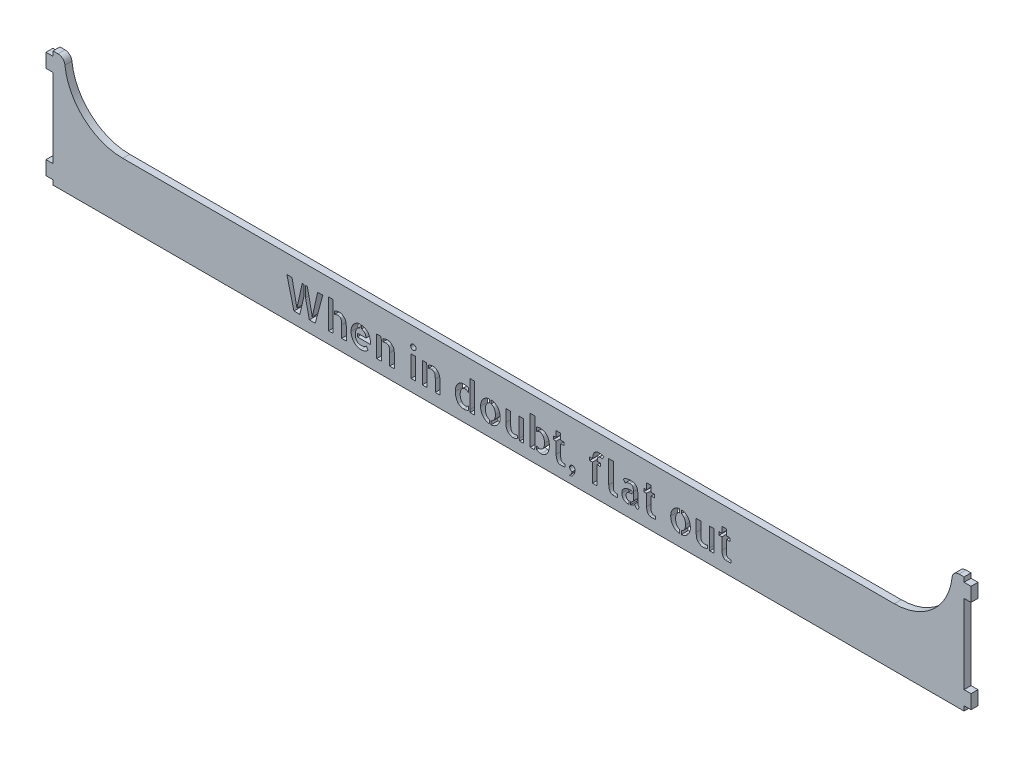
from build123d import *

# Parameters (mm, degrees)
SKETCH1_W           = 3
SKETCH1_H           = 6
BOSS_EXTRUDE1_DEPTH = 3
FILLET1_R           = 3
SKETCH2_W           = 1.968241206
SKETCH2_H           = 12.651256281
SKETCH2_W_2         = 1.985125629
SKETCH2_H_2         = 9.182713568
CUT_EXTRUDE1_DEPTH  = 3


with BuildPart() as part:
    # Sketch1 → Boss-Extrude1 (new body)
    with BuildSketch(Plane.XY):
        with Locations((-197.5, 20)):
            Rectangle(SKETCH1_W, SKETCH1_H)
        with BuildLine():
            Line((-196, 17), (-196, 0))
            Line((-196, 0), (-166, 0))
            ThreePointArc((-166, 0), (-183.67766953, 7.32233047), (-191, 25))
            Line((-191, 25), (-196, 25))
            Line((-196, 25), (-196, 23))
            Line((-196, 23), (-196, 17))
        make_face()
        Polygon((-166, 0), (-196, 0), (-196, -17), (-196, -23), (-196, -25), (196, -25), (196, -23), (196, -17), (196, 0), (166, 0), align=None)
        with Locations((-197.5, -20)):
            Rectangle(SKETCH1_W, SKETCH1_H)
        with Locations((197.5, -20)):
            Rectangle(SKETCH1_W, SKETCH1_H)
        with BuildLine():
            ThreePointArc((191, 25), (183.67766953, 7.32233047), (166, 0))
            Line((166, 0), (196, 0))
            Line((196, 0), (196, 17))
            Line((196, 17), (196, 23))
            Line((196, 23), (196, 25))
            Line((196, 25), (191, 25))
        make_face()
        with Locations((197.5, 20)):
            Rectangle(SKETCH1_W, SKETCH1_H)
    extrude(amount=BOSS_EXTRUDE1_DEPTH)

    # Fillet1
    fillet1_edges = [part.edges().sort_by_distance(p)[0] for p in [
        (-191, 25, 1.5),
        (191, 25, 1.5),
    ]]
    fillet(fillet1_edges, radius=FILLET1_R)

    # Sketch2 → Cut-Extrude1 (cut)
    with BuildSketch(Plane.XY.offset(3)):
        Polygon((-91.04080402, -18.354974874), (-88.761407035, -8), (-87.994371859, -8), (-87.994371859, -12.346532663), (-89.769648241, -20.065125628), (-92.326432161, -20.065125628), (-95.370452261, -8), (-93.156180905, -8), align=None)
        Polygon((-82.133065327, -8), (-79.91879397, -8), (-83.160603015, -20.065125628), (-85.700502513, -20.065125628), (-87.328643216, -12.657688442), (-87.328643216, -8), (-86.547135678, -8), (-84.429346734, -18.354974874), align=None)
        with Locations((-76.421306533, -13.67437186)):
            Rectangle(SKETCH2_W, SKETCH2_H)
        with BuildLine():
            add(Edge.make_bspline(
                [(-70.567236181, -11.825527638), (-70.522944215, -11.873009838), (-70.434756304, -11.967549694), (-70.318129612, -12.122836034), (-70.21883544, -12.290714491), (-70.107971968, -12.529311814), (-69.994784468, -12.84341581), (-69.902610081, -13.235603246), (-69.846506391, -13.637172126), (-69.816155838, -14.040115684), (-69.80652438, -14.440952562), (-69.803911393, -14.706331041), (-69.802613065, -14.838190955)],
                knots=[0, 0, 0, 0, 0.61080383, 1.216146378, 1.823471959, 2.442885967, 3.689936612, 4.958134669, 6.227280472, 7.502300055, 8.758955501, 10, 10, 10, 10], degree=3))
            Line((-69.802613065, -14.838190955), (-69.802613065, -19.674371859))
            Line((-69.802613065, -19.674371859), (-69.802613065, -20))
            Line((-69.802613065, -20), (-71.790150754, -20))
            Line((-71.790150754, -20), (-71.790150754, -15.002211055))
            add(Edge.make_bspline(
                [(-71.790150754, -15.002211055), (-71.792394575, -14.821234473), (-71.796777229, -14.467749318), (-71.827270149, -14.032595846), (-71.864425981, -13.700895962), (-71.917646609, -13.470181615), (-71.980918198, -13.252300282), (-72.063720476, -13.050148208), (-72.157620193, -12.863535366), (-72.27335715, -12.699757752), (-72.403815767, -12.556146234), (-72.552774108, -12.43293874), (-72.726257856, -12.333254406), (-72.929887136, -12.264103684), (-73.164262342, -12.224041544), (-73.330485827, -12.218963712), (-73.418291457, -12.216281407)],
                knots=[0, 0, 0, 0, 2.063446306, 4.030342651, 4.973105725, 5.86515059, 6.726658374, 7.557518502, 8.353076957, 9.103447919, 9.836764699, 10.559923288, 11.299120169, 12.105228101, 12.999108693, 14, 14, 14, 14], degree=3))
            add(Edge.make_bspline(
                [(-73.418291457, -12.216281407), (-73.459336845, -12.217305328), (-73.548074359, -12.21951898), (-73.691056131, -12.236390625), (-73.854102193, -12.256112065), (-74.095240005, -12.303694305), (-74.409558967, -12.374203874), (-74.648891323, -12.476220818), (-74.769045226, -12.527437186)],
                knots=[0, 0, 0, 0, 0.529680917, 1.145136404, 1.856989334, 2.648777967, 4.317559676, 6, 6, 6, 6], degree=3))
            Line((-74.769045226, -12.527437186), (-74.769045226, -11.273165829))
            add(Edge.make_bspline(
                [(-74.769045226, -11.273165829), (-74.617509109, -11.199555908), (-74.308243666, -11.049327663), (-73.899957061, -10.905261122), (-73.564722935, -10.806996107), (-73.312003069, -10.757226335), (-73.063033199, -10.723406748), (-72.897395729, -10.720054119), (-72.815276382, -10.71839196)],
                knots=[0, 0, 0, 0, 1.47892298, 3.018288834, 3.796376008, 4.545755503, 5.27901815, 6, 6, 6, 6], degree=3))
            add(Edge.make_bspline(
                [(-72.815276382, -10.71839196), (-72.697644363, -10.721982746), (-72.470633978, -10.728912371), (-72.143806514, -10.785273737), (-71.844326493, -10.877066786), (-71.57355552, -11.016165468), (-71.319562578, -11.183607141), (-71.067026825, -11.373446589), (-70.814051565, -11.587637714), (-70.65079487, -11.74499064), (-70.567236181, -11.825527638)],
                knots=[0, 0, 0, 0, 1.091950854, 2.107284947, 3.070906179, 3.989338024, 4.923543776, 5.894372448, 6.922289352, 8, 8, 8, 8], degree=3))
        make_face()
        with BuildLine():
            add(Edge.make_bspline(
                [(-63.261105528, -10.735276382), (-63.117489042, -10.752404458), (-62.834926, -10.786103662), (-62.425264997, -10.887085125), (-62.036798638, -11.0241497), (-61.671684797, -11.201941373), (-61.329291426, -11.41138201), (-61.012457686, -11.65128526), (-60.720030375, -11.918561613), (-60.455533923, -12.214781425), (-60.219545622, -12.537519726), (-60.0074396, -12.8792552), (-59.832100117, -13.247788845), (-59.682959272, -13.633830324), (-59.56510256, -14.035643031), (-59.480577441, -14.447834148), (-59.428313742, -14.868198119), (-59.421911584, -15.151610107), (-59.418693467, -15.294070352)],
                knots=[0, 0, 0, 0, 1.056658311, 2.078957625, 3.077434928, 4.063391262, 5.042365449, 6.007635579, 6.964599913, 7.93463772, 8.905814863, 9.88478905, 10.870745384, 11.88495041, 12.908060698, 13.928380565, 14.95867704, 16, 16, 16, 16], degree=3))
            add(Edge.make_bspline(
                [(-59.418693467, -15.294070352), (-59.42071872, -15.42444463), (-59.42477692, -15.68568855), (-59.452864336, -15.945450592), (-59.466934673, -16.075577889)],
                knots=[0, 0, 0, 0, 0.998103827, 2, 2, 2, 2], degree=3))
            Line((-59.466934673, -16.075577889), (-65.050854271, -16.075577889))
            Line((-65.050854271, -16.075577889), (-65.050854271, -14.64281407))
            Line((-65.050854271, -14.64281407), (-61.290452261, -14.64281407))
            add(Edge.make_bspline(
                [(-61.290452261, -14.64281407), (-61.292795707, -14.572830213), (-61.297442083, -14.434072416), (-61.319745565, -14.227494284), (-61.368456879, -14.026776766), (-61.427596993, -13.828688481), (-61.503983902, -13.635954863), (-61.600528389, -13.452015747), (-61.707015249, -13.271857812), (-61.879882393, -13.049540651), (-62.117627109, -12.78741141), (-62.402776003, -12.577638796), (-62.645665305, -12.436459499), (-62.841551987, -12.357020126), (-63.04698561, -12.298012887), (-63.189219311, -12.277368524), (-63.261105528, -12.266934673)],
                knots=[0, 0, 0, 0, 0.875648736, 1.736158786, 2.59225216, 3.454170767, 4.320476351, 5.179340166, 6.050126722, 6.932904018, 8.69696932, 10.456473006, 11.334427602, 12.204517342, 13.092546593, 14, 14, 14, 14], degree=3))
            Line((-63.261105528, -12.266934673), (-63.261105528, -10.735276382))
        make_face()
        with BuildLine():
            add(Edge.make_bspline(
                [(-63.326231156, -18.468341709), (-63.259446932, -18.465947265), (-63.110120306, -18.460593394), (-62.867614995, -18.431739237), (-62.593760309, -18.37401496), (-62.301282268, -18.285268193), (-62.002223815, -18.163485272), (-61.702613041, -18.020582359), (-61.419535632, -17.844020952), (-61.257059114, -17.695039654), (-61.177085427, -17.621708543)],
                knots=[0, 0, 0, 0, 0.679604328, 1.519565779, 2.480358209, 3.523014247, 4.62408012, 5.761628527, 6.898235741, 8, 8, 8, 8], degree=3))
            Line((-61.177085427, -17.621708543), (-60.460703518, -18.714371859))
            add(Edge.make_bspline(
                [(-60.460703518, -18.714371859), (-60.551499751, -18.82126093), (-60.729760376, -19.031116689), (-61.037095331, -19.302293029), (-61.361716911, -19.538257889), (-61.715904534, -19.732774373), (-62.10537763, -19.884576173), (-62.541031223, -19.98862732), (-63.023539083, -20.05412033), (-63.3621838, -20.061357657), (-63.538492462, -20.065125628)],
                knots=[0, 0, 0, 0, 0.962884687, 1.890435528, 2.809135884, 3.716849467, 4.660008601, 5.673338514, 6.788669792, 8, 8, 8, 8], degree=3))
            add(Edge.make_bspline(
                [(-63.538492462, -20.065125628), (-63.685871365, -20.060203047), (-63.976560444, -20.050493782), (-64.405840406, -19.981750925), (-64.819337115, -19.864663412), (-65.217437932, -19.705974702), (-65.592910738, -19.505911317), (-65.941588866, -19.269933459), (-66.265848098, -19.004434348), (-66.556456694, -18.700922702), (-66.820781684, -18.370496202), (-67.051668231, -18.00953868), (-67.261047061, -17.626627231), (-67.435730579, -17.216017803), (-67.579720736, -16.785134655), (-67.678859461, -16.334739075), (-67.745512642, -15.869328125), (-67.751658595, -15.553203044), (-67.754773869, -15.392964824)],
                knots=[0, 0, 0, 0, 1.010106514, 1.99232676, 2.97121678, 3.950665208, 4.924577524, 5.881498951, 6.832753172, 7.791593184, 8.756496667, 9.728770122, 10.72506919, 11.744753508, 12.783518584, 13.834464996, 14.902328561, 16, 16, 16, 16], degree=3))
            add(Edge.make_bspline(
                [(-67.754773869, -15.392964824), (-67.750916113, -15.240040045), (-67.743276552, -14.937201323), (-67.686899112, -14.489856861), (-67.592528767, -14.054727334), (-67.459526467, -13.634964769), (-67.296121127, -13.232282858), (-67.103831367, -12.853424223), (-66.882518969, -12.501289321), (-66.636328599, -12.175308005), (-66.366005539, -11.874927034), (-66.071574014, -11.604919876), (-65.75574134, -11.364548474), (-65.421600938, -11.154513377), (-65.06907422, -10.979639151), (-64.701104847, -10.846762685), (-64.319969292, -10.754641054), (-64.059970639, -10.730519837), (-63.929246231, -10.71839196)],
                knots=[0, 0, 0, 0, 1.106804155, 2.191817174, 3.258060847, 4.325701457, 5.375149816, 6.400698683, 7.397046155, 8.381818038, 9.354319488, 10.318214252, 11.269248844, 12.223643396, 13.171091624, 14.111884337, 15.050676608, 16, 16, 16, 16], degree=3))
            Line((-63.929246231, -10.71839196), (-63.929246231, -12.281407035))
            add(Edge.make_bspline(
                [(-63.929246231, -12.281407035), (-64.025754035, -12.303625365), (-64.213784212, -12.346914262), (-64.476872879, -12.456089854), (-64.716931307, -12.591853925), (-64.923289731, -12.767775991), (-65.109264003, -12.959368259), (-65.269955577, -13.169977263), (-65.417564141, -13.388176689), (-65.574907713, -13.700683347), (-65.727948584, -14.106831247), (-65.831156079, -14.522822212), (-65.880262082, -14.848238909), (-65.910446108, -15.072401591), (-65.928561671, -15.278487919), (-65.930385106, -15.409817813), (-65.931256281, -15.472562814)],
                knots=[0, 0, 0, 0, 1.017869342, 1.983157262, 2.921560874, 3.844653398, 4.763729224, 5.666104131, 6.568327174, 7.471612727, 9.260979002, 11.025611856, 11.872041706, 12.648210099, 13.354160298, 14, 14, 14, 14], degree=3))
            add(Edge.make_bspline(
                [(-65.931256281, -15.472562814), (-65.92952234, -15.577160802), (-65.926127543, -15.781947861), (-65.895845063, -16.084081553), (-65.84887887, -16.37447387), (-65.780899036, -16.652588156), (-65.695834278, -16.91710206), (-65.583999829, -17.16281996), (-65.45305576, -17.391831359), (-65.301846157, -17.602795748), (-65.126176853, -17.790482148), (-64.934596625, -17.962139936), (-64.721774401, -18.110394224), (-64.490899914, -18.241573974), (-64.23427198, -18.342511767), (-63.953760345, -18.417549386), (-63.647555539, -18.460563427), (-63.435712579, -18.465691498), (-63.326231156, -18.468341709)],
                knots=[0, 0, 0, 0, 1.117095835, 2.187104889, 3.240472474, 4.257060902, 5.242999496, 6.204044574, 7.135147059, 8.057733062, 8.969460476, 9.876035356, 10.800618214, 11.734963453, 12.706277988, 13.737563801, 14.830762488, 16, 16, 16, 16], degree=3))
        make_face()
        Polygon((-54.96120603, -10.817286432), (-54.751356784, -11.745929648), (-54.751356784, -20), (-56.71959799, -20), (-56.71959799, -10.817286432), align=None)
        with BuildLine():
            add(Edge.make_bspline(
                [(-49.881407035, -11.825527638), (-49.837115069, -11.873009838), (-49.748927158, -11.967549694), (-49.632300466, -12.122836034), (-49.533006294, -12.290714491), (-49.422142822, -12.529311814), (-49.308955323, -12.84341581), (-49.216780935, -13.235603246), (-49.160677245, -13.637172126), (-49.130326693, -14.040115684), (-49.120695235, -14.440952562), (-49.118082247, -14.706331041), (-49.11678392, -14.838190955)],
                knots=[0, 0, 0, 0, 0.61080383, 1.216146378, 1.823471959, 2.442885967, 3.689936612, 4.958134669, 6.227280472, 7.502300055, 8.758955501, 10, 10, 10, 10], degree=3))
            Line((-49.11678392, -14.838190955), (-49.11678392, -19.674371859))
            Line((-49.11678392, -19.674371859), (-49.11678392, -20))
            Line((-49.11678392, -20), (-51.104321608, -20))
            Line((-51.104321608, -20), (-51.104321608, -15.002211055))
            add(Edge.make_bspline(
                [(-51.104321608, -15.002211055), (-51.10656543, -14.821234473), (-51.110948083, -14.467749318), (-51.141441004, -14.032595846), (-51.178596836, -13.700895962), (-51.231817464, -13.470181615), (-51.295089052, -13.252300282), (-51.37789133, -13.050148208), (-51.471791047, -12.863535366), (-51.587528004, -12.699757752), (-51.717986621, -12.556146234), (-51.866944963, -12.43293874), (-52.040428711, -12.333254406), (-52.24405799, -12.264103684), (-52.478433196, -12.224041544), (-52.644656681, -12.218963712), (-52.732462312, -12.216281407)],
                knots=[0, 0, 0, 0, 2.063446306, 4.030342651, 4.973105725, 5.86515059, 6.726658374, 7.557518502, 8.353076957, 9.103447919, 9.836764699, 10.559923288, 11.299120169, 12.105228101, 12.999108693, 14, 14, 14, 14], degree=3))
            add(Edge.make_bspline(
                [(-52.732462312, -12.216281407), (-52.773507699, -12.217305328), (-52.862245213, -12.21951898), (-53.005226985, -12.236390625), (-53.168273047, -12.256112065), (-53.409410859, -12.303694305), (-53.723729821, -12.374203874), (-53.963062177, -12.476220818), (-54.08321608, -12.527437186)],
                knots=[0, 0, 0, 0, 0.529680917, 1.145136404, 1.856989334, 2.648777967, 4.317559676, 6, 6, 6, 6], degree=3))
            Line((-54.08321608, -12.527437186), (-54.08321608, -11.273165829))
            add(Edge.make_bspline(
                [(-54.08321608, -11.273165829), (-53.931679963, -11.199555908), (-53.62241452, -11.049327663), (-53.214127915, -10.905261122), (-52.878893789, -10.806996107), (-52.626173923, -10.757226335), (-52.377204053, -10.723406748), (-52.211566584, -10.720054119), (-52.129447236, -10.71839196)],
                knots=[0, 0, 0, 0, 1.47892298, 3.018288834, 3.796376008, 4.545755503, 5.27901815, 6, 6, 6, 6], degree=3))
            add(Edge.make_bspline(
                [(-52.129447236, -10.71839196), (-52.011815217, -10.721982746), (-51.784804832, -10.728912371), (-51.457977368, -10.785273737), (-51.158497348, -10.877066786), (-50.887726375, -11.016165468), (-50.633733433, -11.183607141), (-50.38119768, -11.373446589), (-50.128222419, -11.587637714), (-49.964965724, -11.74499064), (-49.881407035, -11.825527638)],
                knots=[0, 0, 0, 0, 1.091950854, 2.107284947, 3.070906179, 3.989338024, 4.923543776, 5.894372448, 6.922289352, 8, 8, 8, 8], degree=3))
        make_face()
        with Locations((-40.924221106, -15.408643216)):
            Rectangle(SKETCH2_W_2, SKETCH2_H_2)
        with BuildLine():
            add(Edge.make_bspline(
                [(-39.750753769, -7.886633166), (-39.75489573, -7.965047478), (-39.762979961, -8.118095614), (-39.827799316, -8.339198855), (-39.938456088, -8.538942343), (-40.088338148, -8.714547928), (-40.267881002, -8.85843393), (-40.469816024, -8.964814036), (-40.690749531, -9.029700907), (-40.844590595, -9.037853867), (-40.923015075, -9.04201005)],
                knots=[0, 0, 0, 0, 1.026542015, 2.003592683, 2.989242921, 3.998494226, 5.010602115, 5.986288028, 6.973457985, 8, 8, 8, 8], degree=3))
            add(Edge.make_bspline(
                [(-40.923015075, -9.04201005), (-41.001409202, -9.037785095), (-41.155190721, -9.029497228), (-41.376235072, -8.965681334), (-41.576643411, -8.855681218), (-41.752309646, -8.7077064), (-41.898047345, -8.529467887), (-42.001876499, -8.329604481), (-42.069017443, -8.113562641), (-42.076810668, -7.963518021), (-42.08080402, -7.886633166)],
                knots=[0, 0, 0, 0, 1.033732368, 2.027816899, 3.005972211, 4.030403807, 5.041336525, 6.023856572, 6.987397882, 8, 8, 8, 8], degree=3))
            add(Edge.make_bspline(
                [(-42.08080402, -7.886633166), (-42.076949978, -7.807324614), (-42.06941615, -7.652293385), (-42.000711403, -7.431020179), (-41.893269953, -7.228294153), (-41.742567364, -7.052505596), (-41.566224235, -6.902424459), (-41.367193057, -6.792497769), (-41.149820541, -6.726427744), (-40.999857915, -6.718456454), (-40.923015075, -6.714371859)],
                knots=[0, 0, 0, 0, 1.038272473, 2.029600274, 3.011394499, 4.029914316, 5.048434134, 6.035260479, 6.993241395, 8, 8, 8, 8], degree=3))
            add(Edge.make_bspline(
                [(-40.923015075, -6.714371859), (-40.844637516, -6.718624265), (-40.690888496, -6.726965978), (-40.468548864, -6.790695766), (-40.267680648, -6.903359164), (-40.088782801, -7.051454191), (-39.939078115, -7.22916672), (-39.82717431, -7.429823773), (-39.763090589, -7.652854948), (-39.754933028, -7.807437741), (-39.750753769, -7.886633166)],
                knots=[0, 0, 0, 0, 1.019921578, 2.00072502, 2.980018543, 3.998811027, 5.009556093, 5.988849616, 6.969653058, 8, 8, 8, 8], degree=3))
        make_face()
        Polygon((-35.355979899, -10.817286432), (-35.146130653, -11.745929648), (-35.146130653, -20), (-37.114371859, -20), (-37.114371859, -10.817286432), align=None)
        with BuildLine():
            add(Edge.make_bspline(
                [(-30.276180905, -11.825527638), (-30.231888939, -11.873009838), (-30.143701028, -11.967549694), (-30.027074336, -12.122836034), (-29.927780164, -12.290714491), (-29.816916691, -12.529311814), (-29.703729192, -12.84341581), (-29.611554804, -13.235603246), (-29.555451115, -13.637172126), (-29.525100562, -14.040115684), (-29.515469104, -14.440952562), (-29.512856117, -14.706331041), (-29.511557789, -14.838190955)],
                knots=[0, 0, 0, 0, 0.61080383, 1.216146378, 1.823471959, 2.442885967, 3.689936612, 4.958134669, 6.227280472, 7.502300055, 8.758955501, 10, 10, 10, 10], degree=3))
            Line((-29.511557789, -14.838190955), (-29.511557789, -19.674371859))
            Line((-29.511557789, -19.674371859), (-29.511557789, -20))
            Line((-29.511557789, -20), (-31.499095477, -20))
            Line((-31.499095477, -20), (-31.499095477, -15.002211055))
            add(Edge.make_bspline(
                [(-31.499095477, -15.002211055), (-31.501339299, -14.821234473), (-31.505721953, -14.467749318), (-31.536214873, -14.032595846), (-31.573370705, -13.700895962), (-31.626591333, -13.470181615), (-31.689862921, -13.252300282), (-31.772665199, -13.050148208), (-31.866564917, -12.863535366), (-31.982301873, -12.699757752), (-32.11276049, -12.556146234), (-32.261718832, -12.43293874), (-32.43520258, -12.333254406), (-32.63883186, -12.264103684), (-32.873207066, -12.224041544), (-33.039430551, -12.218963712), (-33.127236181, -12.216281407)],
                knots=[0, 0, 0, 0, 2.063446306, 4.030342651, 4.973105725, 5.86515059, 6.726658374, 7.557518502, 8.353076957, 9.103447919, 9.836764699, 10.559923288, 11.299120169, 12.105228101, 12.999108693, 14, 14, 14, 14], degree=3))
            add(Edge.make_bspline(
                [(-33.127236181, -12.216281407), (-33.168281569, -12.217305328), (-33.257019083, -12.21951898), (-33.400000855, -12.236390625), (-33.563046916, -12.256112065), (-33.804184729, -12.303694305), (-34.11850369, -12.374203874), (-34.357836047, -12.476220818), (-34.47798995, -12.527437186)],
                knots=[0, 0, 0, 0, 0.529680917, 1.145136404, 1.856989334, 2.648777967, 4.317559676, 6, 6, 6, 6], degree=3))
            Line((-34.47798995, -12.527437186), (-34.47798995, -11.273165829))
            add(Edge.make_bspline(
                [(-34.47798995, -11.273165829), (-34.326453832, -11.199555908), (-34.017188389, -11.049327663), (-33.608901784, -10.905261122), (-33.273667658, -10.806996107), (-33.020947792, -10.757226335), (-32.771977922, -10.723406748), (-32.606340453, -10.720054119), (-32.524221106, -10.71839196)],
                knots=[0, 0, 0, 0, 1.47892298, 3.018288834, 3.796376008, 4.545755503, 5.27901815, 6, 6, 6, 6], degree=3))
            add(Edge.make_bspline(
                [(-32.524221106, -10.71839196), (-32.406589086, -10.721982746), (-32.179578701, -10.728912371), (-31.852751237, -10.785273737), (-31.553271217, -10.877066786), (-31.282500244, -11.016165468), (-31.028507302, -11.183607141), (-30.775971549, -11.373446589), (-30.522996288, -11.587637714), (-30.359739594, -11.74499064), (-30.276180905, -11.825527638)],
                knots=[0, 0, 0, 0, 1.091950854, 2.107284947, 3.070906179, 3.989338024, 4.923543776, 5.894372448, 6.922289352, 8, 8, 8, 8], degree=3))
        make_face()
        Polygon((-14.64361809, -7.348743719), (-14.64361809, -20), (-16.515376884, -20), (-16.628743719, -18.909748744), (-16.628743719, -7.348743719), align=None)
        with BuildLine():
            add(Edge.make_bspline(
                [(-22.88080402, -15.27718593), (-22.876970186, -15.073587869), (-22.869614292, -14.682948732), (-22.804706557, -14.121519299), (-22.695373755, -13.611433989), (-22.542379842, -13.150160298), (-22.352849925, -12.737683212), (-22.13997469, -12.364672726), (-21.90206702, -12.03257043), (-21.635858369, -11.743551889), (-21.351446298, -11.491799309), (-21.049092889, -11.279279306), (-20.732472049, -11.10285757), (-20.402773192, -10.967263918), (-20.067035409, -10.864307349), (-19.733298626, -10.789201254), (-19.401457551, -10.743766318), (-19.181643906, -10.738099078), (-19.072160804, -10.735276382)],
                knots=[0, 0, 0, 0, 1.465391904, 2.811615327, 4.061655456, 5.214841032, 6.302767987, 7.324433161, 8.302827141, 9.236932405, 10.147387435, 11.032255896, 11.892452099, 12.751361954, 13.593569408, 14.417923962, 15.212011648, 16, 16, 16, 16], degree=3))
            add(Edge.make_bspline(
                [(-19.072160804, -10.735276382), (-18.907671004, -10.740444527), (-18.584358685, -10.750602756), (-18.117824891, -10.841721734), (-17.683313673, -10.972316946), (-17.423030117, -11.1083455), (-17.296884422, -11.174271357)],
                knots=[0, 0, 0, 0, 1.066858738, 2.096960264, 3.077697135, 4, 4, 4, 4], degree=3))
            Line((-17.296884422, -11.174271357), (-17.296884422, -12.901306533))
            add(Edge.make_bspline(
                [(-17.296884422, -12.901306533), (-17.392109709, -12.809505266), (-17.58012414, -12.628251279), (-17.856086206, -12.451391925), (-18.092364955, -12.348096178), (-18.278437564, -12.288034964), (-18.477027523, -12.258053225), (-18.612179949, -12.252761005), (-18.681407035, -12.250050251)],
                knots=[0, 0, 0, 0, 1.509643925, 2.980666704, 3.71317203, 4.454388414, 5.20831471, 6, 6, 6, 6], degree=3))
            add(Edge.make_bspline(
                [(-18.681407035, -12.250050251), (-18.763627123, -12.253512906), (-18.923758025, -12.260256733), (-19.157437081, -12.306751641), (-19.376133607, -12.386891835), (-19.579399633, -12.499687707), (-19.768531466, -12.637238326), (-19.939691445, -12.801941676), (-20.101583573, -12.985072692), (-20.241171203, -13.195421592), (-20.366953996, -13.423312071), (-20.477971019, -13.667786333), (-20.57402363, -13.929122043), (-20.656513806, -14.205066911), (-20.717803397, -14.494902396), (-20.764598817, -14.79511685), (-20.790686162, -15.106270535), (-20.794732877, -15.317341935), (-20.79678392, -15.424321608)],
                knots=[0, 0, 0, 0, 0.932094573, 1.815336709, 2.689260637, 3.562375793, 4.443120694, 5.33311239, 6.250783575, 7.209125843, 8.188485949, 9.200279658, 10.250249345, 11.343536001, 12.462928955, 13.60659829, 14.78692551, 16, 16, 16, 16], degree=3))
            add(Edge.make_bspline(
                [(-20.79678392, -15.424321608), (-20.795214987, -15.531340608), (-20.792129023, -15.741838382), (-20.759339854, -16.051250025), (-20.708846415, -16.349398116), (-20.639821245, -16.63592919), (-20.550024724, -16.907791622), (-20.446898603, -17.163287673), (-20.329960975, -17.401834103), (-20.201673788, -17.624120957), (-20.054582726, -17.82483991), (-19.890784382, -18.00224259), (-19.715308414, -18.160176683), (-19.523832866, -18.293992587), (-19.318614572, -18.40024804), (-19.103114344, -18.477959413), (-18.878096887, -18.525993185), (-18.725060324, -18.53095641), (-18.647638191, -18.533467337)],
                knots=[0, 0, 0, 0, 1.227357478, 2.414113558, 3.565092595, 4.694882496, 5.791656369, 6.846796086, 7.853362698, 8.83736075, 9.787485868, 10.70146151, 11.603065295, 12.490975925, 13.373841431, 14.246236657, 15.112760395, 16, 16, 16, 16], degree=3))
            add(Edge.make_bspline(
                [(-18.647638191, -18.533467337), (-18.582423959, -18.531589026), (-18.453749334, -18.52788292), (-18.264751378, -18.499259956), (-18.084141973, -18.446845962), (-17.910423886, -18.377916576), (-17.744708465, -18.286443724), (-17.585558713, -18.178519512), (-17.433855223, -18.049412886), (-17.343267617, -17.94999831), (-17.296884422, -17.899095477)],
                knots=[0, 0, 0, 0, 1.015309029, 2.003312862, 2.96633243, 3.93810101, 4.907285525, 5.90735161, 6.928509951, 8, 8, 8, 8], degree=3))
            Line((-17.296884422, -17.899095477), (-17.296884422, -19.592361809))
            add(Edge.make_bspline(
                [(-17.296884422, -19.592361809), (-17.363936853, -19.627166272), (-17.501397777, -19.698517205), (-17.721879403, -19.788033673), (-17.955592743, -19.873067352), (-18.203199393, -19.948105799), (-18.461853988, -20.00756058), (-18.729137334, -20.052249864), (-19.004219639, -20.075227089), (-19.190316415, -20.079732), (-19.284422111, -20.08201005)],
                knots=[0, 0, 0, 0, 0.876643472, 1.797164079, 2.759744532, 3.763794646, 4.798572159, 5.839017888, 6.907231342, 8, 8, 8, 8], degree=3))
            add(Edge.make_bspline(
                [(-19.284422111, -20.08201005), (-19.392343886, -20.079501466), (-19.608361248, -20.074480257), (-19.929981558, -20.025064114), (-20.250134306, -19.953995633), (-20.565233633, -19.851024311), (-20.870508299, -19.713940239), (-21.159701909, -19.538444687), (-21.43278389, -19.325414618), (-21.594723317, -19.157077316), (-21.67718593, -19.071356784)],
                knots=[0, 0, 0, 0, 0.967317371, 1.936192636, 2.912393994, 3.906700598, 4.90401017, 5.907039501, 6.934225009, 8, 8, 8, 8], degree=3))
            add(Edge.make_bspline(
                [(-21.67718593, -19.071356784), (-21.777159924, -18.950019443), (-21.979093393, -18.704935005), (-22.221920806, -18.284772003), (-22.434910175, -17.831048278), (-22.596312432, -17.337970735), (-22.721653879, -16.826936974), (-22.814614622, -16.309852399), (-22.868183189, -15.79289385), (-22.876610047, -15.44855855), (-22.88080402, -15.27718593)],
                knots=[0, 0, 0, 0, 0.927534149, 1.873489111, 2.85766039, 3.885284315, 4.93269433, 5.965292125, 6.987343963, 8, 8, 8, 8], degree=3))
        make_face()
        with BuildLine():
            add(Edge.make_bspline(
                [(-7.484623116, -10.769045226), (-7.337872334, -10.781188093), (-7.049409594, -10.80505689), (-6.629913286, -10.894088929), (-6.230388896, -11.021272902), (-5.855261218, -11.194269525), (-5.502478915, -11.398597259), (-5.17745811, -11.635462242), (-4.883584258, -11.90545482), (-4.620628537, -12.205728179), (-4.385931033, -12.533569084), (-4.178104693, -12.886163456), (-3.999418599, -13.265251388), (-3.847908067, -13.666714481), (-3.727345012, -14.088607913), (-3.64121759, -14.526686665), (-3.585806828, -14.979080196), (-3.580017037, -15.285867166), (-3.577085427, -15.44120603)],
                knots=[0, 0, 0, 0, 1.044722858, 2.053574183, 3.037564271, 4.016106713, 4.980625159, 5.928422644, 6.865881028, 7.808453978, 8.757523052, 9.724926583, 10.710687287, 11.729713132, 12.768804863, 13.822413058, 14.897398148, 16, 16, 16, 16], degree=3))
            add(Edge.make_bspline(
                [(-3.577085427, -15.44120603), (-3.580061876, -15.5957346), (-3.585939931, -15.900906152), (-3.640716272, -16.351157431), (-3.729399434, -16.787048869), (-3.854860675, -17.205597387), (-4.011400884, -17.60302389), (-4.194913734, -17.976042026), (-4.405058463, -18.32333621), (-4.644402519, -18.642299977), (-4.911789771, -18.934854519), (-5.208461111, -19.197660442), (-5.53460708, -19.43050617), (-5.88540426, -19.633121262), (-6.260277862, -19.79872247), (-6.652114082, -19.930578658), (-7.062472296, -20.020244876), (-7.342741819, -20.050041589), (-7.484623116, -20.065125628)],
                knots=[0, 0, 0, 0, 1.106779111, 2.185728504, 3.244324831, 4.290481212, 5.312082913, 6.301372403, 7.265622848, 8.216129645, 9.153895077, 10.100641286, 11.050222437, 12.020545286, 12.9979219, 13.981627271, 14.978235895, 16, 16, 16, 16], degree=3))
            Line((-7.484623116, -20.065125628), (-7.484623116, -18.502110553))
            add(Edge.make_bspline(
                [(-7.484623116, -18.502110553), (-7.417420901, -18.485133549), (-7.28472783, -18.451611876), (-7.093931956, -18.374750733), (-6.912532061, -18.278188425), (-6.740281918, -18.159924338), (-6.581128887, -18.017283991), (-6.427755916, -17.858172282), (-6.286272682, -17.676187774), (-6.153880231, -17.47631476), (-6.034234346, -17.261102283), (-5.930362724, -17.032519621), (-5.840458732, -16.793526179), (-5.768900698, -16.543287958), (-5.713453965, -16.282857428), (-5.672191331, -16.012346351), (-5.647759108, -15.730305492), (-5.645412284, -15.538540364), (-5.644221106, -15.44120603)],
                knots=[0, 0, 0, 0, 0.862964866, 1.703953641, 2.555618301, 3.419978046, 4.300334091, 5.214535364, 6.17065783, 7.168298529, 8.199877862, 9.235584986, 10.294537016, 11.379061552, 12.475645425, 13.6106923, 14.787257737, 16, 16, 16, 16], degree=3))
            add(Edge.make_bspline(
                [(-5.644221106, -15.44120603), (-5.645330626, -15.342253398), (-5.647517049, -15.147257242), (-5.673262475, -14.859089156), (-5.710764692, -14.580337191), (-5.764399666, -14.311425984), (-5.830683099, -14.052952269), (-5.915609147, -13.807438811), (-6.013637657, -13.574279457), (-6.130477314, -13.357654219), (-6.257910724, -13.154921162), (-6.396263666, -12.967474145), (-6.553189619, -12.804300912), (-6.715966688, -12.654948102), (-6.893239457, -12.52989459), (-7.078828635, -12.424605435), (-7.276962346, -12.345690943), (-7.414964081, -12.314191439), (-7.484623116, -12.298291457)],
                knots=[0, 0, 0, 0, 1.206478328, 2.377487413, 3.525735358, 4.635357377, 5.719912831, 6.777354597, 7.800974567, 8.801171334, 9.775114959, 10.720400997, 11.636080551, 12.531854535, 13.410723559, 14.275530654, 15.129540873, 16, 16, 16, 16], degree=3))
            Line((-7.484623116, -12.298291457), (-7.484623116, -10.769045226))
        make_face()
        with BuildLine():
            add(Edge.make_bspline(
                [(-12.026532663, -15.407437186), (-12.023572385, -15.25290756), (-12.017726265, -14.947733923), (-11.962927418, -14.499224256), (-11.876040261, -14.066905318), (-11.756311509, -13.65159822), (-11.601383636, -13.257984819), (-11.421634865, -12.885617625), (-11.206967845, -12.542084017), (-10.966903554, -12.221951195), (-10.694114682, -11.933210529), (-10.401239895, -11.667191517), (-10.076232173, -11.439163001), (-9.732592856, -11.234794327), (-9.364181335, -11.066891154), (-8.977709895, -10.929541615), (-8.570127184, -10.836273551), (-8.291423206, -10.801246973), (-8.150351759, -10.783517588)],
                knots=[0, 0, 0, 0, 1.112820148, 2.197658678, 3.249525204, 4.287004796, 5.306675896, 6.293611338, 7.261219819, 8.220401132, 9.171151153, 10.118737801, 11.065421218, 12.026018014, 12.995289291, 13.977146802, 14.976093453, 16, 16, 16, 16], degree=3))
            Line((-8.150351759, -10.783517588), (-8.150351759, -12.298291457))
            add(Edge.make_bspline(
                [(-8.150351759, -12.298291457), (-8.216683465, -12.315464543), (-8.349113257, -12.34975023), (-8.539874139, -12.42458028), (-8.719876678, -12.521525022), (-8.88775492, -12.642227634), (-9.046629691, -12.781497162), (-9.195027937, -12.942656256), (-9.331733432, -13.124409607), (-9.459853177, -13.323612827), (-9.571350673, -13.540155033), (-9.670984369, -13.767957623), (-9.755820178, -14.006332048), (-9.821791085, -14.256940179), (-9.87971267, -14.516271505), (-9.912743676, -14.788547602), (-9.939452971, -15.070026753), (-9.941482456, -15.261838157), (-9.942512563, -15.35919598)],
                knots=[0, 0, 0, 0, 0.85867219, 1.714320145, 2.562450234, 3.415718742, 4.301603457, 5.207739906, 6.157531389, 7.150440849, 8.174150573, 9.208136185, 10.266847495, 11.343034162, 12.456363992, 13.595687353, 14.779641667, 16, 16, 16, 16], degree=3))
            add(Edge.make_bspline(
                [(-9.942512563, -15.35919598), (-9.936325656, -15.554895236), (-9.924216009, -15.937937815), (-9.848764604, -16.406132178), (-9.758387559, -16.758383192), (-9.675425648, -17.005225747), (-9.581927639, -17.239134806), (-9.476500108, -17.459348288), (-9.356426965, -17.662721194), (-9.220043407, -17.846535549), (-9.073244276, -18.013706508), (-8.913639395, -18.162448227), (-8.740620027, -18.287915905), (-8.555179568, -18.388173909), (-8.357999645, -18.462500594), (-8.220015078, -18.488821897), (-8.150351759, -18.502110553)],
                knots=[0, 0, 0, 0, 2.096834449, 4.104138609, 5.06550086, 5.991938501, 6.892777867, 7.763739395, 8.606055967, 9.41949473, 10.213066864, 10.987461465, 11.752742104, 12.496821617, 13.241100667, 14, 14, 14, 14], degree=3))
            Line((-8.150351759, -18.502110553), (-8.150351759, -20.065125628))
            add(Edge.make_bspline(
                [(-8.150351759, -20.065125628), (-8.296325398, -20.050414436), (-8.583321457, -20.021491035), (-9.000139324, -19.927650129), (-9.395692752, -19.798800331), (-9.766300785, -19.626056346), (-10.109943923, -19.417441875), (-10.431821714, -19.183357161), (-10.724011328, -18.916101433), (-10.991030102, -18.621354678), (-11.227049529, -18.295739561), (-11.437724392, -17.946269506), (-11.617156494, -17.568768534), (-11.764985226, -17.167241068), (-11.884014953, -16.746531966), (-11.963939958, -16.310290723), (-12.017312162, -15.863030602), (-12.02343778, -15.560358196), (-12.026532663, -15.407437186)],
                knots=[0, 0, 0, 0, 1.048047519, 2.060546738, 3.047549508, 4.017074348, 4.976235138, 5.917804722, 6.857758781, 7.801973942, 8.756213491, 9.728188865, 10.715459397, 11.739396715, 12.783986546, 13.836924786, 14.90713643, 16, 16, 16, 16], degree=3))
        make_face()
        with BuildLine():
            add(Edge.make_bspline(
                [(0.928643216, -15.815075377), (0.930899626, -15.998459496), (0.935278581, -16.354348143), (0.965122994, -16.790388791), (1.003188962, -17.118635905), (1.054847552, -17.343884263), (1.109203538, -17.556832024), (1.18506192, -17.753017218), (1.275275373, -17.934137663), (1.390916436, -18.094411272), (1.523976666, -18.237807523), (1.67727396, -18.363265513), (1.855975605, -18.464203035), (2.061643834, -18.532153358), (2.291917425, -18.577320898), (2.454431515, -18.581777058), (2.539899497, -18.584120603)],
                knots=[0, 0, 0, 0, 2.104817037, 4.084762027, 5.015471689, 5.893433029, 6.735286994, 7.535750917, 8.303515627, 9.051327685, 9.795771846, 10.543868623, 11.316609893, 12.136784214, 13.020113919, 14, 14, 14, 14], degree=3))
            add(Edge.make_bspline(
                [(2.539899497, -18.584120603), (2.579318627, -18.582888161), (2.66553123, -18.580192719), (2.805463471, -18.567020957), (2.967310621, -18.548117002), (3.211386831, -18.509094682), (3.527296552, -18.441587547), (3.771740498, -18.351464451), (3.893065327, -18.306733668)],
                knots=[0, 0, 0, 0, 0.511421805, 1.118517964, 1.822190378, 2.62457492, 4.324675748, 6, 6, 6, 6], degree=3))
            Line((3.893065327, -18.306733668), (3.893065327, -19.510351759))
            add(Edge.make_bspline(
                [(3.893065327, -19.510351759), (3.747080456, -19.584418457), (3.448020658, -19.736149056), (3.053568635, -19.887293018), (2.72672665, -19.988771929), (2.478764315, -20.040764771), (2.233065289, -20.077588284), (2.068876711, -20.080545196), (1.987537688, -20.08201005)],
                knots=[0, 0, 0, 0, 1.46606846, 3.003339553, 3.778279975, 4.530033878, 5.271778776, 6, 6, 6, 6], degree=3))
            add(Edge.make_bspline(
                [(1.987537688, -20.08201005), (1.863531942, -20.07824328), (1.62794652, -20.071087192), (1.290748877, -20.019090753), (0.984862391, -19.924014072), (0.706207646, -19.784590533), (0.443288455, -19.619439629), (0.191221531, -19.431783262), (-0.055366262, -19.222261102), (-0.211618309, -19.068373496), (-0.291859296, -18.989346734)],
                knots=[0, 0, 0, 0, 1.140773642, 2.167235363, 3.128843999, 4.075077838, 5.025466655, 5.982740358, 6.964065374, 8, 8, 8, 8], degree=3))
            add(Edge.make_bspline(
                [(-0.291859296, -18.989346734), (-0.337417082, -18.943038509), (-0.428613111, -18.850340277), (-0.541175955, -18.691117413), (-0.648460777, -18.52668672), (-0.764494584, -18.288674184), (-0.880754876, -17.975051849), (-0.977256246, -17.583096695), (-1.030022758, -17.181736054), (-1.052900882, -16.777792493), (-1.053740524, -16.37707965), (-1.055574005, -16.110950497), (-1.056482412, -15.979095477)],
                knots=[0, 0, 0, 0, 0.609257256, 1.219590484, 1.827300626, 2.452229234, 3.702291853, 4.962695042, 6.236023471, 7.499704226, 8.761215958, 10, 10, 10, 10], degree=3))
            Line((-1.056482412, -15.979095477), (-1.056482412, -10.817286432))
            Line((-1.056482412, -10.817286432), (0.928643216, -10.817286432))
            Line((0.928643216, -10.817286432), (0.928643216, -15.815075377))
        make_face()
        Polygon((6.546331658, -10.817286432), (6.546331658, -20), (4.771055276, -20), (4.55879397, -19.054472362), (4.55879397, -10.817286432), align=None)
        with BuildLine():
            Line((9.351557789, -7.348743719), (11.319798995, -7.348743719))
            Line((11.319798995, -7.348743719), (11.319798995, -18.909748744))
            add(Edge.make_bspline(
                [(11.319798995, -18.909748744), (11.313916854, -18.991005811), (11.301321887, -19.164995199), (11.270055909, -19.43374237), (11.244374002, -19.715993892), (11.230292885, -19.905909062), (11.223316583, -20)],
                knots=[0, 0, 0, 0, 0.89306077, 1.912241015, 2.96564765, 4, 4, 4, 4], degree=3))
            Line((11.223316583, -20), (9.351557789, -20))
            Line((9.351557789, -20), (9.351557789, -7.348743719))
        make_face()
        with BuildLine():
            add(Edge.make_bspline(
                [(17.376482412, -13.60080402), (17.406243089, -13.728314988), (17.46689874, -13.988196868), (17.528666156, -14.391104978), (17.565199972, -14.812577164), (17.569608938, -15.099422046), (17.571859296, -15.245829146)],
                knots=[0, 0, 0, 0, 0.945818162, 1.927685168, 2.942279873, 4, 4, 4, 4], degree=3))
            add(Edge.make_bspline(
                [(17.571859296, -15.245829146), (17.568932527, -15.399490028), (17.563099376, -15.705741355), (17.520609056, -16.161586101), (17.453954805, -16.612161194), (17.35733442, -17.052672502), (17.23779805, -17.479297651), (17.081094993, -17.880630295), (16.90165117, -18.258918571), (16.690646508, -18.608659134), (16.456360659, -18.932765841), (16.184891171, -19.217543906), (15.890420312, -19.473393866), (15.566082358, -19.692119079), (15.211388179, -19.867601896), (14.825877475, -19.99351858), (14.410240224, -20.069631597), (14.122942485, -20.077811463), (13.975477387, -20.08201005)],
                knots=[0, 0, 0, 0, 1.093010144, 2.178406122, 3.254265627, 4.331280043, 5.384862611, 6.402462909, 7.3925076, 8.359702735, 9.304638495, 10.231254795, 11.151920514, 12.075194331, 13.006301314, 13.957706536, 14.951725107, 16, 16, 16, 16], degree=3))
            add(Edge.make_bspline(
                [(13.975477387, -20.08201005), (13.881319555, -20.081157267), (13.69422156, -20.079462728), (13.417644733, -20.049488387), (13.146255659, -20.013920583), (12.884711727, -19.955067553), (12.635566492, -19.882595339), (12.400623435, -19.802307838), (12.184951269, -19.706261041), (12.052469288, -19.629668606), (11.987939698, -19.592361809)],
                knots=[0, 0, 0, 0, 1.090537696, 2.166972327, 3.221157943, 4.261123207, 5.269683307, 6.2274216, 7.136608948, 8, 8, 8, 8], degree=3))
            Line((11.987939698, -19.592361809), (11.987939698, -17.899095477))
            add(Edge.make_bspline(
                [(11.987939698, -17.899095477), (12.07329778, -17.987081946), (12.245063165, -18.164136413), (12.507543265, -18.33193148), (12.735174917, -18.436903904), (12.918109846, -18.490746874), (13.109766406, -18.52665746), (13.240432852, -18.531161287), (13.307336683, -18.533467337)],
                knots=[0, 0, 0, 0, 1.45826144, 2.934447861, 3.681257516, 4.442699935, 5.202631253, 6, 6, 6, 6], degree=3))
            add(Edge.make_bspline(
                [(13.307336683, -18.533467337), (13.387158049, -18.530963296), (13.544160504, -18.52603804), (13.773429839, -18.478742505), (13.990394977, -18.400238942), (14.196048757, -18.293470447), (14.388706666, -18.160230749), (14.567279826, -18.004855771), (14.733723846, -17.82996888), (14.881945512, -17.631182571), (15.017709575, -17.413387939), (15.13749997, -17.17530049), (15.247155994, -16.9199293), (15.337529301, -16.644450255), (15.412519871, -16.355438265), (15.464539087, -16.053676748), (15.500685671, -15.742789251), (15.503366407, -15.531363111), (15.504723618, -15.424321608)],
                knots=[0, 0, 0, 0, 0.908292162, 1.786540474, 2.65267311, 3.529200864, 4.418268723, 5.31424307, 6.221195397, 7.162631032, 8.133364707, 9.140896335, 10.195483225, 11.295952261, 12.439842535, 13.593151909, 14.781453249, 16, 16, 16, 16], degree=3))
            add(Edge.make_bspline(
                [(15.504723618, -15.424321608), (15.502932306, -15.319729205), (15.499397768, -15.113352089), (15.469424869, -14.807973173), (15.421552901, -14.510576793), (15.35402097, -14.222226108), (15.270226252, -13.945833276), (15.170798062, -13.684049828), (15.058575662, -13.438284105), (14.930626395, -13.210468115), (14.787656666, -13.002352855), (14.63282999, -12.813069112), (14.457791788, -12.649882281), (14.271947591, -12.507270797), (14.06974151, -12.391838254), (13.854266789, -12.309766337), (13.625589199, -12.259707853), (13.469199435, -12.253314633), (13.389346734, -12.250050251)],
                knots=[0, 0, 0, 0, 1.191382215, 2.35078284, 3.492277855, 4.621021639, 5.722145561, 6.780330469, 7.809084316, 8.797573726, 9.752911254, 10.68297035, 11.577199297, 12.473068818, 13.34679478, 14.219511793, 15.090881722, 16, 16, 16, 16], degree=3))
            add(Edge.make_bspline(
                [(13.389346734, -12.250050251), (13.320020941, -12.251341104), (13.183709744, -12.253879232), (12.984463846, -12.290793605), (12.793338663, -12.341495456), (12.613368556, -12.41915373), (12.44058571, -12.511286083), (12.282013556, -12.631434151), (12.124777321, -12.761284413), (12.034021629, -12.865350542), (11.987939698, -12.918190955)],
                knots=[0, 0, 0, 0, 1.034828053, 2.034721071, 3.020425329, 3.984792112, 4.958477384, 5.939406449, 6.953717089, 8, 8, 8, 8], degree=3))
            Line((11.987939698, -12.918190955), (11.987939698, -11.174271357))
            add(Edge.make_bspline(
                [(11.987939698, -11.174271357), (12.118218328, -11.10853661), (12.384264042, -10.974297804), (12.821752952, -10.842077833), (13.284305012, -10.751216169), (13.602765469, -10.740616723), (13.76321608, -10.735276382)],
                knots=[0, 0, 0, 0, 0.946492297, 1.932858976, 2.958507931, 4, 4, 4, 4], degree=3))
            add(Edge.make_bspline(
                [(13.76321608, -10.735276382), (13.944618617, -10.742370494), (14.312342451, -10.756751075), (14.767738416, -10.851967316), (15.126823515, -10.965309411), (15.392359479, -11.074219071), (15.647444685, -11.209311257), (15.892458245, -11.369798291), (16.127523315, -11.555078099), (16.355794179, -11.763494174), (16.566090194, -12.006072427), (16.772552925, -12.267094305), (16.962859659, -12.557370821), (17.124218341, -12.880006826), (17.269911065, -13.227823217), (17.340398601, -13.474517084), (17.376482412, -13.60080402)],
                knots=[0, 0, 0, 0, 1.526965931, 3.095335811, 3.89840643, 4.696924928, 5.508712639, 6.325708412, 7.16014102, 8.027446291, 8.924380431, 9.860365144, 10.829515706, 11.841008636, 12.89477429, 14, 14, 14, 14], degree=3))
        make_face()
        with BuildLine():
            add(Edge.make_bspline(
                [(22.468341709, -17.216482412), (22.470235258, -17.303379826), (22.473821815, -17.467971532), (22.499055031, -17.7000622), (22.543911815, -17.902861854), (22.608704449, -18.077009749), (22.693708474, -18.224728962), (22.78966176, -18.354116733), (22.902658195, -18.463872546), (23.071408598, -18.587705053), (23.317504791, -18.693717464), (23.639518973, -18.764882132), (23.984381797, -18.787335554), (24.221112927, -18.791720947), (24.342512563, -18.793969849)],
                knots=[0, 0, 0, 0, 1.090229957, 2.06499595, 2.923941616, 3.69021651, 4.385909477, 5.055742785, 5.704899128, 6.35460391, 7.672868174, 9.02858063, 10.476207046, 12, 12, 12, 12], degree=3))
            Line((24.342512563, -18.793969849), (24.342512563, -20))
            add(Edge.make_bspline(
                [(24.342512563, -20), (24.271804004, -20.00924212), (24.130566921, -20.027702828), (23.988788699, -20.0414009), (23.91798995, -20.048241206)],
                knots=[0, 0, 0, 0, 1.001274699, 2, 2, 2, 2], degree=3))
            add(Edge.make_bspline(
                [(23.91798995, -20.048241206), (23.852077488, -20.053290416), (23.708300058, -20.064304455), (23.481549065, -20.076586358), (23.23779585, -20.079763089), (23.072159203, -20.081261098), (22.989346734, -20.08201005)],
                knots=[0, 0, 0, 0, 0.853400472, 1.861555839, 2.93085349, 4, 4, 4, 4], degree=3))
            add(Edge.make_bspline(
                [(22.989346734, -20.08201005), (22.907327799, -20.080812316), (22.741601215, -20.078392187), (22.498516459, -20.067463797), (22.271615201, -20.046436878), (22.128983371, -20.026220434), (22.063115578, -20.016884422)],
                knots=[0, 0, 0, 0, 1.059131876, 2.140070584, 3.141079193, 4, 4, 4, 4], degree=3))
            add(Edge.make_bspline(
                [(22.063115578, -20.016884422), (21.974519451, -19.997460923), (21.804151678, -19.960110098), (21.569479132, -19.854895633), (21.363054254, -19.718324077), (21.194598989, -19.539446303), (21.053409305, -19.341955541), (20.926151137, -19.135062094), (20.816795096, -18.918728433), (20.704500651, -18.618413401), (20.602093784, -18.241379984), (20.542810737, -17.866874098), (20.522224167, -17.586413096), (20.509672509, -17.403118534), (20.501849761, -17.243887009), (20.500650653, -17.145735433), (20.500100503, -17.100703518)],
                knots=[0, 0, 0, 0, 1.057663399, 2.033855918, 2.987900955, 3.93166037, 4.88658452, 5.823062638, 6.768738697, 7.7147416, 9.566068565, 11.325968571, 12.136887111, 12.852694721, 13.473616657, 14, 14, 14, 14], degree=3))
            Line((20.500100503, -17.100703518), (20.500100503, -12.151155779))
            Line((20.500100503, -12.151155779), (19.294070352, -12.151155779))
            Line((19.294070352, -12.151155779), (19.294070352, -10.817286432))
            Line((19.294070352, -10.817286432), (20.500100503, -10.817286432))
            Line((20.500100503, -10.817286432), (20.500100503, -8.212261307))
            Line((20.500100503, -8.212261307), (22.468341709, -8.212261307))
            Line((22.468341709, -8.212261307), (22.468341709, -10.817286432))
            Line((22.468341709, -10.817286432), (23.934874372, -10.817286432))
            Line((23.934874372, -10.817286432), (23.934874372, -12.151155779))
            Line((23.934874372, -12.151155779), (22.468341709, -12.151155779))
            Line((22.468341709, -12.151155779), (22.468341709, -17.216482412))
        make_face()
        with BuildLine():
            add(Edge.make_bspline(
                [(27.454070352, -17.737487437), (27.533267942, -17.741664879), (27.687854962, -17.749818893), (27.910855617, -17.813928226), (28.111628498, -17.925734832), (28.288419342, -18.075413699), (28.437438453, -18.251784603), (28.54882073, -18.449131287), (28.61416854, -18.666120647), (28.622210732, -18.816042417), (28.626331658, -18.892864322)],
                knots=[0, 0, 0, 0, 1.039205634, 2.028441805, 3.016155074, 4.035590301, 5.055025527, 6.033494643, 6.992336557, 8, 8, 8, 8], degree=3))
            add(Edge.make_bspline(
                [(28.626331658, -18.892864322), (28.626580566, -18.911364428), (28.62719806, -18.957259791), (28.620079363, -19.039134199), (28.616734693, -19.148583907), (28.609700952, -19.282977308), (28.597030099, -19.440631177), (28.563829106, -19.615172056), (28.518060144, -19.807017184), (28.455049087, -20.013127786), (28.375657686, -20.2336978), (28.274541138, -20.464365929), (28.149708703, -20.703457088), (28.007036634, -20.952818919), (27.831434074, -21.204681277), (27.624119161, -21.459298823), (27.375409624, -21.710033178), (27.192186362, -21.870486506), (27.097085427, -21.953768844)],
                knots=[0, 0, 0, 0, 0.25086118, 0.62234048, 1.113640348, 1.736200277, 2.448169781, 3.256908045, 4.143131795, 5.123064383, 6.178849218, 7.321745433, 8.536396364, 9.836528166, 11.216167651, 12.696510212, 14.28534344, 16, 16, 16, 16], degree=3))
            Line((27.097085427, -21.953768844), (26.330050251, -21.953768844))
            add(Edge.make_bspline(
                [(26.330050251, -21.953768844), (26.432055231, -21.850294431), (26.630410733, -21.649081516), (26.866416824, -21.314262332), (27.05731101, -20.993273408), (27.161784704, -20.781339436), (27.210452261, -20.682613065)],
                knots=[0, 0, 0, 0, 1.1195689, 2.177076582, 3.150817536, 4, 4, 4, 4], degree=3))
            add(Edge.make_bspline(
                [(27.210452261, -20.682613065), (27.257447947, -20.580474699), (27.350082323, -20.3791472), (27.41974785, -20.168772229), (27.454070352, -20.065125628)],
                knots=[0, 0, 0, 0, 1.014648928, 2, 2, 2, 2], degree=3))
            add(Edge.make_bspline(
                [(27.454070352, -20.065125628), (27.375545476, -20.061305063), (27.222051515, -20.053836937), (27.002673458, -19.984432995), (26.801007184, -19.878118044), (26.626281008, -19.727283789), (26.482237314, -19.548064646), (26.375898055, -19.346045773), (26.311000356, -19.125134493), (26.302848889, -18.971290365), (26.298693467, -18.892864322)],
                knots=[0, 0, 0, 0, 1.026801156, 2.007106334, 2.987977999, 3.99748408, 5.009847467, 5.985779684, 6.973198844, 8, 8, 8, 8], degree=3))
            add(Edge.make_bspline(
                [(26.298693467, -18.892864322), (26.302869769, -18.814447563), (26.311062195, -18.660621646), (26.375461467, -18.440267435), (26.481790078, -18.240400139), (26.626355481, -18.065068762), (26.802673678, -17.920429812), (27.001635613, -17.8117403), (27.223006305, -17.750373157), (27.375715958, -17.741857017), (27.454070352, -17.737487437)],
                knots=[0, 0, 0, 0, 1.032625714, 2.025646036, 2.997739061, 3.999378095, 5.001017129, 5.987452815, 6.967374286, 8, 8, 8, 8], degree=3))
        make_face()
        with BuildLine():
            add(Edge.make_bspline(
                [(39.36241206, -8.71638191), (39.309941178, -8.717793123), (39.208792527, -8.720513535), (39.064375459, -8.753896956), (38.931711265, -8.802974339), (38.815159245, -8.87876762), (38.707430528, -8.967401589), (38.614493642, -9.077222443), (38.52236528, -9.196698625), (38.421340795, -9.388155622), (38.312024387, -9.657604899), (38.234618099, -10.018487472), (38.181798382, -10.409064743), (38.166596834, -10.678821756), (38.15879397, -10.817286432)],
                knots=[0, 0, 0, 0, 0.701026461, 1.351375807, 1.975076097, 2.584397634, 3.203248506, 3.836170175, 4.505745807, 5.218818138, 6.726024165, 8.384096166, 10.143977993, 12, 12, 12, 12], degree=3))
            Line((38.15879397, -10.817286432), (39.574673367, -10.817286432))
            Line((39.574673367, -10.817286432), (39.574673367, -12.151155779))
            Line((39.574673367, -12.151155779), (38.125025126, -12.151155779))
            Line((38.125025126, -12.151155779), (38.125025126, -12.932663317))
            Line((38.125025126, -12.932663317), (38.125025126, -20))
            Line((38.125025126, -20), (36.139899497, -20))
            Line((36.139899497, -20), (36.139899497, -12.932663317))
            Line((36.139899497, -12.932663317), (36.139899497, -12.151155779))
            Line((36.139899497, -12.151155779), (34.933869347, -12.151155779))
            Line((34.933869347, -12.151155779), (34.933869347, -10.817286432))
            Line((34.933869347, -10.817286432), (36.171256281, -10.817286432))
            add(Edge.make_bspline(
                [(36.171256281, -10.817286432), (36.193063212, -10.58858007), (36.236055284, -10.13768854), (36.334230517, -9.58505365), (36.445272544, -9.164967455), (36.551683736, -8.873054701), (36.677454064, -8.600603858), (36.824282977, -8.347506222), (36.998615772, -8.116118282), (37.203076765, -7.910358575), (37.434509213, -7.727917398), (37.69488471, -7.568962351), (37.989122679, -7.441179299), (38.317687515, -7.345777069), (38.683055957, -7.295096078), (38.937745525, -7.287551955), (39.070552764, -7.28361809)],
                knots=[0, 0, 0, 0, 1.865448585, 3.677706895, 4.550490612, 5.39120008, 6.197505189, 6.984787267, 7.763136904, 8.54345608, 9.333792113, 10.151282945, 11.013845669, 11.931401577, 12.921334519, 14, 14, 14, 14], degree=3))
            add(Edge.make_bspline(
                [(39.070552764, -7.28361809), (39.155074373, -7.285361876), (39.329492894, -7.288960347), (39.59492747, -7.323310947), (39.865584598, -7.369203017), (40.133844069, -7.42105003), (40.390099811, -7.481378728), (40.623234607, -7.556346342), (40.827552188, -7.632541037), (40.940033827, -7.706348364), (40.990552764, -7.739497487)],
                knots=[0, 0, 0, 0, 1.017295313, 2.099287332, 3.218202862, 4.323252313, 5.389317379, 6.384442269, 7.274403715, 8, 8, 8, 8], degree=3))
            Line((40.990552764, -7.739497487), (40.356180905, -8.911758794))
            add(Edge.make_bspline(
                [(40.356180905, -8.911758794), (40.274748911, -8.872221974), (40.1023407, -8.788514426), (39.861979184, -8.753571412), (39.671947097, -8.737214585), (39.548382822, -8.72266501), (39.447656289, -8.718967425), (39.388139595, -8.717162243), (39.36241206, -8.71638191)],
                knots=[0, 0, 0, 0, 1.58594699, 3.357774656, 4.225683137, 4.951288852, 5.546669158, 6, 6, 6, 6], degree=3))
        make_face()
        with BuildLine():
            add(Edge.make_bspline(
                [(45.112763819, -17.19959799), (45.114699386, -17.286491113), (45.118383323, -17.451873532), (45.143352058, -17.685590412), (45.188752972, -17.890395687), (45.251605301, -18.067302029), (45.33144573, -18.21989904), (45.429768528, -18.348029284), (45.538130984, -18.459487643), (45.706933452, -18.575491402), (45.946466873, -18.682608429), (46.267174251, -18.754378785), (46.616349315, -18.786823408), (46.859036132, -18.791534089), (46.984522613, -18.793969849)],
                knots=[0, 0, 0, 0, 1.086077777, 2.067116063, 2.932589306, 3.701876166, 4.40769796, 5.074980183, 5.71451916, 6.341861658, 7.623503095, 8.966553745, 10.43149083, 12, 12, 12, 12], degree=3))
            Line((46.984522613, -18.793969849), (46.984522613, -20))
            add(Edge.make_bspline(
                [(46.984522613, -20), (46.913016053, -20.009309237), (46.76700697, -20.028317745), (46.620357119, -20.041509823), (46.545527638, -20.048241206)],
                knots=[0, 0, 0, 0, 0.97948099, 2, 2, 2, 2], degree=3))
            add(Edge.make_bspline(
                [(46.545527638, -20.048241206), (46.480419022, -20.053283009), (46.339051686, -20.064230042), (46.116327052, -20.076605589), (45.877393673, -20.07975846), (45.714973141, -20.081259557), (45.633768844, -20.08201005)],
                knots=[0, 0, 0, 0, 0.85863221, 1.864308529, 2.932232756, 4, 4, 4, 4], degree=3))
            add(Edge.make_bspline(
                [(45.633768844, -20.08201005), (45.551749094, -20.080849529), (45.388429877, -20.078538677), (45.147762155, -20.067281209), (44.920151605, -20.045733497), (44.774218857, -20.026154352), (44.705125628, -20.016884422)],
                knots=[0, 0, 0, 0, 1.056473021, 2.103668271, 3.102163939, 4, 4, 4, 4], degree=3))
            add(Edge.make_bspline(
                [(44.705125628, -20.016884422), (44.616469377, -19.994944898), (44.445906674, -19.952736204), (44.212494158, -19.842294944), (44.005690558, -19.706544802), (43.837260219, -19.530238313), (43.695180582, -19.336141109), (43.565163505, -19.133502957), (43.457001302, -18.917068373), (43.336889507, -18.619573996), (43.232631315, -18.241590033), (43.169403087, -17.8670983), (43.150801676, -17.586275153), (43.134055775, -17.403231413), (43.127119589, -17.243876385), (43.125821633, -17.145732092), (43.125226131, -17.100703518)],
                knots=[0, 0, 0, 0, 1.06533516, 2.049561575, 3.003881356, 3.941195056, 4.881286127, 5.815010021, 6.752559411, 7.705720896, 9.562632794, 11.324519969, 12.135672036, 12.852364323, 13.47346507, 14, 14, 14, 14], degree=3))
            Line((43.125226131, -17.100703518), (43.125226131, -16.905326633))
            Line((43.125226131, -16.905326633), (43.125226131, -7.348743719))
            Line((43.125226131, -7.348743719), (45.112763819, -7.348743719))
            Line((45.112763819, -7.348743719), (45.112763819, -17.19959799))
        make_face()
        with BuildLine():
            add(Edge.make_bspline(
                [(50.619497487, -17.230954774), (50.622913781, -17.345377698), (50.629335782, -17.560471698), (50.683679759, -17.861142947), (50.775547716, -18.117602532), (50.911323301, -18.326609368), (51.084640966, -18.490940307), (51.289850407, -18.617130597), (51.529453142, -18.705597927), (51.701800865, -18.731965783), (51.791758794, -18.745728643)],
                knots=[0, 0, 0, 0, 1.279085282, 2.404444503, 3.403357839, 4.306330989, 5.165045905, 6.053526482, 6.984026455, 8, 8, 8, 8], degree=3))
            Line((51.791758794, -18.745728643), (51.791758794, -20.065125628))
            add(Edge.make_bspline(
                [(51.791758794, -20.065125628), (51.763671184, -20.069735331), (51.693448414, -20.081260203), (51.622230034, -20.081728851), (51.579497487, -20.08201005)],
                knots=[0, 0, 0, 0, 0.799957338, 2, 2, 2, 2], degree=3))
            add(Edge.make_bspline(
                [(51.579497487, -20.08201005), (51.488588225, -20.079927795), (51.307197343, -20.075773079), (51.037827573, -20.049397576), (50.772655237, -20.003000738), (50.514506367, -19.938563196), (50.26484427, -19.856524813), (50.032533352, -19.744748908), (49.811009187, -19.618892094), (49.607889726, -19.464808846), (49.419610135, -19.289947462), (49.259069126, -19.082805076), (49.11116024, -18.855961219), (48.991672227, -18.597316177), (48.894084315, -18.311581286), (48.828446717, -17.994795526), (48.786990535, -17.648539154), (48.781797007, -17.407164489), (48.779095477, -17.28160804)],
                knots=[0, 0, 0, 0, 0.966075426, 1.927606372, 2.872943808, 3.824093549, 4.753544448, 5.659408745, 6.559168247, 7.456287069, 8.362836086, 9.280867701, 10.233666115, 11.235027432, 12.299568661, 13.435758555, 14.666152271, 16, 16, 16, 16], degree=3))
            add(Edge.make_bspline(
                [(48.779095477, -17.28160804), (48.782333448, -17.160717482), (48.788636974, -16.925373549), (48.850984838, -16.585876269), (48.948269775, -16.270647308), (49.090908165, -15.984410523), (49.263798716, -15.725649048), (49.453475604, -15.485712932), (49.671491411, -15.275780884), (49.907866901, -15.085821721), (50.16713357, -14.924000562), (50.440877128, -14.779034403), (50.734223837, -14.662034103), (51.041742355, -14.56647037), (51.359423915, -14.491708049), (51.681210423, -14.440533359), (52.004762836, -14.403262793), (52.220997953, -14.40055603), (52.329648241, -14.39919598)],
                knots=[0, 0, 0, 0, 1.13198143, 2.203687085, 3.223728245, 4.214568481, 5.188558478, 6.137145938, 7.075046866, 8.018923092, 8.974310976, 9.934944945, 10.918710331, 11.929298952, 12.951092307, 13.974412904, 14.982216095, 16, 16, 16, 16], degree=3))
            Line((52.329648241, -14.39919598), (53.046030151, -14.39919598))
            Line((53.046030151, -14.39919598), (53.046030151, -15.554572864))
            Line((53.046030151, -15.554572864), (52.686633166, -15.554572864))
            add(Edge.make_bspline(
                [(52.686633166, -15.554572864), (52.575562412, -15.558459281), (52.346036889, -15.566490486), (51.999622968, -15.612586604), (51.653857377, -15.703048201), (51.383883949, -15.830519211), (51.185698679, -15.961805686), (51.049928296, -16.081449751), (50.92636759, -16.219538357), (50.816731498, -16.377243868), (50.726010939, -16.556547724), (50.664219725, -16.761318586), (50.625048506, -16.988239021), (50.621395493, -17.147965341), (50.619497487, -17.230954774)],
                knots=[0, 0, 0, 0, 1.323785108, 2.735575823, 4.155599002, 5.565503122, 6.269640979, 6.982523008, 7.715277245, 8.472668721, 9.265292562, 10.098560883, 11.012064178, 12, 12, 12, 12], degree=3))
        make_face()
        with BuildLine():
            add(Edge.make_bspline(
                [(55.68241206, -17.28160804), (55.683808487, -17.33548483), (55.687124369, -17.463417879), (55.698589217, -17.675919659), (55.720996839, -17.921004879), (55.760615685, -18.175435168), (55.820030099, -18.422247311), (55.895733729, -18.612184214), (55.971689136, -18.745275224), (56.041017371, -18.822893419), (56.115877844, -18.887013738), (56.174464155, -18.911915055), (56.203417085, -18.924221106)],
                knots=[0, 0, 0, 0, 0.896623701, 2.129076435, 3.539962731, 4.989198546, 6.410194323, 7.75404849, 8.378029612, 8.946805554, 9.479518925, 10, 10, 10, 10], degree=3))
            Line((56.203417085, -18.924221106), (55.68241206, -20.016884422))
            add(Edge.make_bspline(
                [(55.68241206, -20.016884422), (55.609531548, -20.011779418), (55.456470352, -20.001058062), (55.227416151, -19.923410003), (54.997057046, -19.805155085), (54.775294622, -19.647357993), (54.575314735, -19.4573393), (54.399417441, -19.248759446), (54.260417039, -19.015894341), (54.20030903, -18.847422785), (54.170050251, -18.762613065)],
                knots=[0, 0, 0, 0, 0.840106303, 1.764362933, 2.764303785, 3.822296057, 4.892099894, 5.939791578, 6.962877152, 8, 8, 8, 8], degree=3))
            add(Edge.make_bspline(
                [(54.170050251, -18.762613065), (54.138646267, -18.829928924), (54.073905433, -18.968703824), (53.926722264, -19.156537083), (53.74394042, -19.333841046), (53.524924833, -19.494717719), (53.281406018, -19.640196588), (53.019755544, -19.76452127), (52.746524524, -19.873279682), (52.556159302, -19.925402463), (52.459899497, -19.951758794)],
                knots=[0, 0, 0, 0, 0.826084374, 1.703012923, 2.641456335, 3.660049427, 4.725702766, 5.800483521, 6.887795659, 8, 8, 8, 8], degree=3))
            Line((52.459899497, -19.951758794), (52.459899497, -18.714371859))
            add(Edge.make_bspline(
                [(52.459899497, -18.714371859), (52.52387397, -18.698980501), (52.650780414, -18.668448594), (52.832954546, -18.596249436), (53.007142364, -18.508404832), (53.222429084, -18.36018487), (53.473874112, -18.147172426), (53.634014822, -17.938445156), (53.714170854, -17.833969849)],
                knots=[0, 0, 0, 0, 0.754300825, 1.496309866, 2.243294093, 2.988052173, 4.492414662, 6, 6, 6, 6], degree=3))
            Line((53.714170854, -17.833969849), (53.714170854, -14.39919598))
            add(Edge.make_bspline(
                [(53.714170854, -14.39919598), (53.713271632, -14.272955597), (53.711569885, -14.034049979), (53.698380079, -13.695996341), (53.671907095, -13.399032699), (53.637083157, -13.140982841), (53.589620913, -12.917734751), (53.52771667, -12.72764224), (53.45460593, -12.565960753), (53.360013856, -12.438110414), (53.255118999, -12.335454654), (53.140014197, -12.253553784), (53.012064077, -12.195097021), (52.819810479, -12.144145583), (52.547101689, -12.110381316), (52.320891299, -12.105523588), (52.199396985, -12.102914573)],
                knots=[0, 0, 0, 0, 1.621282147, 3.068221153, 4.343363399, 5.448802873, 6.410877123, 7.269658465, 8.013259471, 8.678292303, 9.298957928, 9.891950207, 10.483322038, 11.094640799, 12.439573782, 14, 14, 14, 14], degree=3))
            add(Edge.make_bspline(
                [(52.199396985, -12.102914573), (52.082396499, -12.106415326), (51.85357119, -12.113261972), (51.525302207, -12.186101554), (51.220551816, -12.283003626), (50.941276743, -12.398080481), (50.687392144, -12.523826541), (50.476384192, -12.665153134), (50.303399471, -12.789419914), (50.205191184, -12.868029762), (50.16361809, -12.901306533)],
                knots=[0, 0, 0, 0, 1.257281748, 2.458946047, 3.603010949, 4.69745764, 5.707635625, 6.646213325, 7.426921068, 8, 8, 8, 8], degree=3))
            Line((50.16361809, -12.901306533), (49.430351759, -11.777286432))
            add(Edge.make_bspline(
                [(49.430351759, -11.777286432), (49.460353556, -11.746934907), (49.524544418, -11.681995777), (49.638574665, -11.591955394), (49.771581036, -11.50024001), (49.981037566, -11.375263193), (50.277533445, -11.223331438), (50.676989385, -11.068176474), (51.118331884, -10.937191678), (51.595278638, -10.834085109), (52.100035246, -10.76326599), (52.445986774, -10.755898665), (52.621507538, -10.752160804)],
                knots=[0, 0, 0, 0, 0.373837325, 0.799850109, 1.271047603, 1.789628851, 2.937066051, 4.187060602, 5.540688009, 6.968826238, 8.462114226, 10, 10, 10, 10], degree=3))
            add(Edge.make_bspline(
                [(52.621507538, -10.752160804), (52.782641267, -10.756392568), (53.10265477, -10.764796902), (53.495687224, -10.831276064), (53.800984742, -10.901980019), (54.017732695, -10.978799744), (54.226122177, -11.066592396), (54.422598708, -11.174195112), (54.609243597, -11.297010713), (54.784704808, -11.439304417), (54.942536443, -11.6061025), (55.094222971, -11.786044623), (55.227890807, -11.988812843), (55.336327698, -12.217499917), (55.426265153, -12.467873475), (55.466422516, -12.645903915), (55.487035176, -12.737286432)],
                knots=[0, 0, 0, 0, 1.770444458, 3.516123749, 4.371710422, 5.213295809, 6.041020824, 6.855993278, 7.672546762, 8.495536469, 9.333351773, 10.193676051, 11.081367278, 11.994794015, 12.970733496, 14, 14, 14, 14], degree=3))
            add(Edge.make_bspline(
                [(55.487035176, -12.737286432), (55.522124609, -12.928227636), (55.592138314, -13.309211314), (55.644515664, -13.886196364), (55.677331423, -14.460695048), (55.680721655, -14.842964329), (55.68241206, -15.033567839)],
                knots=[0, 0, 0, 0, 1.008802417, 2.012856562, 3.00918925, 4, 4, 4, 4], degree=3))
            Line((55.68241206, -15.033567839), (55.68241206, -17.151356784))
            Line((55.68241206, -17.151356784), (55.68241206, -17.28160804))
        make_face()
        with BuildLine():
            add(Edge.make_bspline(
                [(61.370050251, -17.216482412), (61.371943801, -17.303379826), (61.375530358, -17.467971532), (61.400763574, -17.7000622), (61.445620358, -17.902861854), (61.510412992, -18.077009749), (61.595417017, -18.224728962), (61.691370303, -18.354116733), (61.804366738, -18.463872546), (61.973117141, -18.587705053), (62.219213334, -18.693717464), (62.541227516, -18.764882132), (62.88609034, -18.787335554), (63.12282147, -18.791720947), (63.244221106, -18.793969849)],
                knots=[0, 0, 0, 0, 1.090229957, 2.06499595, 2.923941616, 3.69021651, 4.385909477, 5.055742785, 5.704899128, 6.35460391, 7.672868174, 9.02858063, 10.476207046, 12, 12, 12, 12], degree=3))
            Line((63.244221106, -18.793969849), (63.244221106, -20))
            add(Edge.make_bspline(
                [(63.244221106, -20), (63.173512547, -20.00924212), (63.032275464, -20.027702828), (62.890497241, -20.0414009), (62.819698492, -20.048241206)],
                knots=[0, 0, 0, 0, 1.001274699, 2, 2, 2, 2], degree=3))
            add(Edge.make_bspline(
                [(62.819698492, -20.048241206), (62.753786031, -20.053290416), (62.6100086, -20.064304455), (62.383257607, -20.076586358), (62.139504393, -20.079763089), (61.973867746, -20.081261098), (61.891055276, -20.08201005)],
                knots=[0, 0, 0, 0, 0.853400472, 1.861555839, 2.93085349, 4, 4, 4, 4], degree=3))
            add(Edge.make_bspline(
                [(61.891055276, -20.08201005), (61.809036342, -20.080812316), (61.643309758, -20.078392187), (61.400225002, -20.067463797), (61.173323744, -20.046436878), (61.030691914, -20.026220434), (60.964824121, -20.016884422)],
                knots=[0, 0, 0, 0, 1.059131876, 2.140070584, 3.141079193, 4, 4, 4, 4], degree=3))
            add(Edge.make_bspline(
                [(60.964824121, -20.016884422), (60.876227993, -19.997460923), (60.70586022, -19.960110098), (60.471187674, -19.854895633), (60.264762797, -19.718324077), (60.096307532, -19.539446303), (59.955117847, -19.341955541), (59.82785968, -19.135062094), (59.718503639, -18.918728433), (59.606209194, -18.618413401), (59.503802327, -18.241379984), (59.44451928, -17.866874098), (59.423932709, -17.586413096), (59.411381052, -17.403118534), (59.403558304, -17.243887009), (59.402359196, -17.145735433), (59.401809045, -17.100703518)],
                knots=[0, 0, 0, 0, 1.057663399, 2.033855918, 2.987900955, 3.93166037, 4.88658452, 5.823062638, 6.768738697, 7.7147416, 9.566068565, 11.325968571, 12.136887111, 12.852694721, 13.473616657, 14, 14, 14, 14], degree=3))
            Line((59.401809045, -17.100703518), (59.401809045, -12.151155779))
            Line((59.401809045, -12.151155779), (58.195778894, -12.151155779))
            Line((58.195778894, -12.151155779), (58.195778894, -10.817286432))
            Line((58.195778894, -10.817286432), (59.401809045, -10.817286432))
            Line((59.401809045, -10.817286432), (59.401809045, -8.212261307))
            Line((59.401809045, -8.212261307), (61.370050251, -8.212261307))
            Line((61.370050251, -8.212261307), (61.370050251, -10.817286432))
            Line((61.370050251, -10.817286432), (62.836582915, -10.817286432))
            Line((62.836582915, -10.817286432), (62.836582915, -12.151155779))
            Line((62.836582915, -12.151155779), (61.370050251, -12.151155779))
            Line((61.370050251, -12.151155779), (61.370050251, -17.216482412))
        make_face()
        with BuildLine():
            add(Edge.make_bspline(
                [(74.332462312, -10.769045226), (74.479213094, -10.781188093), (74.767675833, -10.80505689), (75.187172141, -10.894088929), (75.586696531, -11.021272902), (75.96182421, -11.194269525), (76.314606512, -11.398597259), (76.639627317, -11.635462242), (76.933501169, -11.90545482), (77.19645689, -12.205728179), (77.431154394, -12.533569084), (77.638980734, -12.886163456), (77.817666828, -13.265251388), (77.96917736, -13.666714481), (78.089740415, -14.088607913), (78.175867837, -14.526686665), (78.231278599, -14.979080196), (78.23706839, -15.285867166), (78.24, -15.44120603)],
                knots=[0, 0, 0, 0, 1.044722858, 2.053574183, 3.037564271, 4.016106713, 4.980625159, 5.928422644, 6.865881028, 7.808453978, 8.757523052, 9.724926583, 10.710687287, 11.729713132, 12.768804863, 13.822413058, 14.897398148, 16, 16, 16, 16], degree=3))
            add(Edge.make_bspline(
                [(78.24, -15.44120603), (78.237023551, -15.5957346), (78.231145496, -15.900906152), (78.176369155, -16.351157431), (78.087685993, -16.787048869), (77.962224753, -17.205597387), (77.805684544, -17.60302389), (77.622171693, -17.976042026), (77.412026964, -18.32333621), (77.172682908, -18.642299977), (76.905295656, -18.934854519), (76.608624316, -19.197660442), (76.282478347, -19.43050617), (75.931681167, -19.633121262), (75.556807566, -19.79872247), (75.164971345, -19.930578658), (74.754613131, -20.020244876), (74.474343608, -20.050041589), (74.332462312, -20.065125628)],
                knots=[0, 0, 0, 0, 1.106779111, 2.185728504, 3.244324831, 4.290481212, 5.312082913, 6.301372403, 7.265622848, 8.216129645, 9.153895077, 10.100641286, 11.050222437, 12.020545286, 12.9979219, 13.981627271, 14.978235895, 16, 16, 16, 16], degree=3))
            Line((74.332462312, -20.065125628), (74.332462312, -18.502110553))
            add(Edge.make_bspline(
                [(74.332462312, -18.502110553), (74.399664526, -18.485133549), (74.532357598, -18.451611876), (74.723153471, -18.374750733), (74.904553366, -18.278188425), (75.076803509, -18.159924338), (75.23595654, -18.017283991), (75.389329511, -17.858172282), (75.530812745, -17.676187774), (75.663205196, -17.47631476), (75.782851081, -17.261102283), (75.886722703, -17.032519621), (75.976626695, -16.793526179), (76.048184729, -16.543287958), (76.103631462, -16.282857428), (76.144894096, -16.012346351), (76.16932632, -15.730305492), (76.171673143, -15.538540364), (76.172864322, -15.44120603)],
                knots=[0, 0, 0, 0, 0.862964866, 1.703953641, 2.555618301, 3.419978046, 4.300334091, 5.214535364, 6.17065783, 7.168298529, 8.199877862, 9.235584986, 10.294537016, 11.379061552, 12.475645425, 13.6106923, 14.787257737, 16, 16, 16, 16], degree=3))
            add(Edge.make_bspline(
                [(76.172864322, -15.44120603), (76.171754801, -15.342253398), (76.169568378, -15.147257242), (76.143822952, -14.859089156), (76.106320735, -14.580337191), (76.052685761, -14.311425984), (75.986402328, -14.052952269), (75.90147628, -13.807438811), (75.80344777, -13.574279457), (75.686608113, -13.357654219), (75.559174703, -13.154921162), (75.420821761, -12.967474145), (75.263895808, -12.804300912), (75.101118739, -12.654948102), (74.92384597, -12.52989459), (74.738256792, -12.424605435), (74.540123081, -12.345690943), (74.402121346, -12.314191439), (74.332462312, -12.298291457)],
                knots=[0, 0, 0, 0, 1.206478328, 2.377487413, 3.525735358, 4.635357377, 5.719912831, 6.777354597, 7.800974567, 8.801171334, 9.775114959, 10.720400997, 11.636080551, 12.531854535, 13.410723559, 14.275530654, 15.129540873, 16, 16, 16, 16], degree=3))
            Line((74.332462312, -12.298291457), (74.332462312, -10.769045226))
        make_face()
        with BuildLine():
            add(Edge.make_bspline(
                [(69.790552764, -15.407437186), (69.793513042, -15.25290756), (69.799359162, -14.947733923), (69.854158009, -14.499224256), (69.941045166, -14.066905318), (70.060773918, -13.65159822), (70.215701792, -13.257984819), (70.395450563, -12.885617625), (70.610117582, -12.542084017), (70.850181873, -12.221951195), (71.122970745, -11.933210529), (71.415845532, -11.667191517), (71.740853254, -11.439163001), (72.084492571, -11.234794327), (72.452904093, -11.066891154), (72.839375532, -10.929541615), (73.246958243, -10.836273551), (73.525662221, -10.801246973), (73.666733668, -10.783517588)],
                knots=[0, 0, 0, 0, 1.112820148, 2.197658678, 3.249525204, 4.287004796, 5.306675896, 6.293611338, 7.261219819, 8.220401132, 9.171151153, 10.118737801, 11.065421218, 12.026018014, 12.995289291, 13.977146802, 14.976093453, 16, 16, 16, 16], degree=3))
            Line((73.666733668, -10.783517588), (73.666733668, -12.298291457))
            add(Edge.make_bspline(
                [(73.666733668, -12.298291457), (73.600401962, -12.315464543), (73.46797217, -12.34975023), (73.277211288, -12.42458028), (73.09720875, -12.521525022), (72.929330507, -12.642227634), (72.770455736, -12.781497162), (72.62205749, -12.942656256), (72.485351996, -13.124409607), (72.35723225, -13.323612827), (72.245734754, -13.540155033), (72.146101059, -13.767957623), (72.061265249, -14.006332048), (71.995294342, -14.256940179), (71.937372758, -14.516271505), (71.904341751, -14.788547602), (71.877632456, -15.070026753), (71.875602971, -15.261838157), (71.874572864, -15.35919598)],
                knots=[0, 0, 0, 0, 0.85867219, 1.714320145, 2.562450234, 3.415718742, 4.301603457, 5.207739906, 6.157531389, 7.150440849, 8.174150573, 9.208136185, 10.266847495, 11.343034162, 12.456363992, 13.595687353, 14.779641667, 16, 16, 16, 16], degree=3))
            add(Edge.make_bspline(
                [(71.874572864, -15.35919598), (71.880759771, -15.554895236), (71.892869418, -15.937937815), (71.968320824, -16.406132178), (72.058697868, -16.758383192), (72.141659779, -17.005225747), (72.235157788, -17.239134806), (72.340585319, -17.459348288), (72.460658462, -17.662721194), (72.59704202, -17.846535549), (72.743841151, -18.013706508), (72.903446032, -18.162448227), (73.0764654, -18.287915905), (73.261905859, -18.388173909), (73.459085782, -18.462500594), (73.597070349, -18.488821897), (73.666733668, -18.502110553)],
                knots=[0, 0, 0, 0, 2.096834449, 4.104138609, 5.06550086, 5.991938501, 6.892777867, 7.763739395, 8.606055967, 9.41949473, 10.213066864, 10.987461465, 11.752742104, 12.496821617, 13.241100667, 14, 14, 14, 14], degree=3))
            Line((73.666733668, -18.502110553), (73.666733668, -20.065125628))
            add(Edge.make_bspline(
                [(73.666733668, -20.065125628), (73.520760029, -20.050414436), (73.23376397, -20.021491035), (72.816946103, -19.927650129), (72.421392675, -19.798800331), (72.050784642, -19.626056346), (71.707141504, -19.417441875), (71.385263714, -19.183357161), (71.093074099, -18.916101433), (70.826055325, -18.621354678), (70.590035898, -18.295739561), (70.379361036, -17.946269506), (70.199928933, -17.568768534), (70.052100201, -17.167241068), (69.933070474, -16.746531966), (69.853145469, -16.310290723), (69.799773265, -15.863030602), (69.793647647, -15.560358196), (69.790552764, -15.407437186)],
                knots=[0, 0, 0, 0, 1.048047519, 2.060546738, 3.047549508, 4.017074348, 4.976235138, 5.917804722, 6.857758781, 7.801973942, 8.756213491, 9.728188865, 10.715459397, 11.739396715, 12.783986546, 13.836924786, 14.90713643, 16, 16, 16, 16], degree=3))
        make_face()
        with BuildLine():
            add(Edge.make_bspline(
                [(82.745728643, -15.815075377), (82.747985053, -15.998459496), (82.752364008, -16.354348143), (82.782208421, -16.790388791), (82.82027439, -17.118635905), (82.871932979, -17.343884263), (82.926288965, -17.556832024), (83.002147347, -17.753017218), (83.0923608, -17.934137663), (83.208001863, -18.094411272), (83.341062093, -18.237807523), (83.494359387, -18.363265513), (83.673061033, -18.464203035), (83.878729261, -18.532153358), (84.109002852, -18.577320898), (84.271516942, -18.581777058), (84.356984925, -18.584120603)],
                knots=[0, 0, 0, 0, 2.104817037, 4.084762027, 5.015471689, 5.893433029, 6.735286994, 7.535750917, 8.303515627, 9.051327685, 9.795771846, 10.543868623, 11.316609893, 12.136784214, 13.020113919, 14, 14, 14, 14], degree=3))
            add(Edge.make_bspline(
                [(84.356984925, -18.584120603), (84.396404054, -18.582888161), (84.482616657, -18.580192719), (84.622548898, -18.567020957), (84.784396048, -18.548117002), (85.028472258, -18.509094682), (85.344381979, -18.441587547), (85.588825925, -18.351464451), (85.710150754, -18.306733668)],
                knots=[0, 0, 0, 0, 0.511421805, 1.118517964, 1.822190378, 2.62457492, 4.324675748, 6, 6, 6, 6], degree=3))
            Line((85.710150754, -18.306733668), (85.710150754, -19.510351759))
            add(Edge.make_bspline(
                [(85.710150754, -19.510351759), (85.564165883, -19.584418457), (85.265106085, -19.736149056), (84.870654062, -19.887293018), (84.543812077, -19.988771929), (84.295849742, -20.040764771), (84.050150716, -20.077588284), (83.885962138, -20.080545196), (83.804623116, -20.08201005)],
                knots=[0, 0, 0, 0, 1.46606846, 3.003339553, 3.778279975, 4.530033878, 5.271778776, 6, 6, 6, 6], degree=3))
            add(Edge.make_bspline(
                [(83.804623116, -20.08201005), (83.680617369, -20.07824328), (83.445031948, -20.071087192), (83.107834304, -20.019090753), (82.801947818, -19.924014072), (82.523293073, -19.784590533), (82.260373882, -19.619439629), (82.008306959, -19.431783262), (81.761719166, -19.222261102), (81.605467118, -19.068373496), (81.525226131, -18.989346734)],
                knots=[0, 0, 0, 0, 1.140773642, 2.167235363, 3.128843999, 4.075077838, 5.025466655, 5.982740358, 6.964065374, 8, 8, 8, 8], degree=3))
            add(Edge.make_bspline(
                [(81.525226131, -18.989346734), (81.479668345, -18.943038509), (81.388472316, -18.850340277), (81.275909472, -18.691117413), (81.16862465, -18.52668672), (81.052590843, -18.288674184), (80.936330551, -17.975051849), (80.839829181, -17.583096695), (80.787062669, -17.181736054), (80.764184546, -16.777792493), (80.763344903, -16.37707965), (80.761511422, -16.110950497), (80.760603015, -15.979095477)],
                knots=[0, 0, 0, 0, 0.609257256, 1.219590484, 1.827300626, 2.452229234, 3.702291853, 4.962695042, 6.236023471, 7.499704226, 8.761215958, 10, 10, 10, 10], degree=3))
            Line((80.760603015, -15.979095477), (80.760603015, -10.817286432))
            Line((80.760603015, -10.817286432), (82.745728643, -10.817286432))
            Line((82.745728643, -10.817286432), (82.745728643, -15.815075377))
        make_face()
        Polygon((88.363417085, -10.817286432), (88.363417085, -20), (86.588140704, -20), (86.375879397, -19.054472362), (86.375879397, -10.817286432), align=None)
        with BuildLine():
            add(Edge.make_bspline(
                [(93.788140704, -17.216482412), (93.790034253, -17.303379826), (93.79362081, -17.467971532), (93.818854026, -17.7000622), (93.86371081, -17.902861854), (93.928503444, -18.077009749), (94.013507469, -18.224728962), (94.109460755, -18.354116733), (94.22245719, -18.463872546), (94.391207593, -18.587705053), (94.637303786, -18.693717464), (94.959317968, -18.764882132), (95.304180792, -18.787335554), (95.540911922, -18.791720947), (95.662311558, -18.793969849)],
                knots=[0, 0, 0, 0, 1.090229957, 2.06499595, 2.923941616, 3.69021651, 4.385909477, 5.055742785, 5.704899128, 6.35460391, 7.672868174, 9.02858063, 10.476207046, 12, 12, 12, 12], degree=3))
            Line((95.662311558, -18.793969849), (95.662311558, -20))
            add(Edge.make_bspline(
                [(95.662311558, -20), (95.591602999, -20.00924212), (95.450365916, -20.027702828), (95.308587694, -20.0414009), (95.237788945, -20.048241206)],
                knots=[0, 0, 0, 0, 1.001274699, 2, 2, 2, 2], degree=3))
            add(Edge.make_bspline(
                [(95.237788945, -20.048241206), (95.171876483, -20.053290416), (95.028099053, -20.064304455), (94.80134806, -20.076586358), (94.557594845, -20.079763089), (94.391958198, -20.081261098), (94.309145729, -20.08201005)],
                knots=[0, 0, 0, 0, 0.853400472, 1.861555839, 2.93085349, 4, 4, 4, 4], degree=3))
            add(Edge.make_bspline(
                [(94.309145729, -20.08201005), (94.227126794, -20.080812316), (94.06140021, -20.078392187), (93.818315454, -20.067463797), (93.591414196, -20.046436878), (93.448782366, -20.026220434), (93.382914573, -20.016884422)],
                knots=[0, 0, 0, 0, 1.059131876, 2.140070584, 3.141079193, 4, 4, 4, 4], degree=3))
            add(Edge.make_bspline(
                [(93.382914573, -20.016884422), (93.294318446, -19.997460923), (93.123950673, -19.960110098), (92.889278127, -19.854895633), (92.682853249, -19.718324077), (92.514397984, -19.539446303), (92.3732083, -19.341955541), (92.245950132, -19.135062094), (92.136594091, -18.918728433), (92.024299646, -18.618413401), (91.921892779, -18.241379984), (91.862609732, -17.866874098), (91.842023162, -17.586413096), (91.829471504, -17.403118534), (91.821648756, -17.243887009), (91.820449648, -17.145735433), (91.819899497, -17.100703518)],
                knots=[0, 0, 0, 0, 1.057663399, 2.033855918, 2.987900955, 3.93166037, 4.88658452, 5.823062638, 6.768738697, 7.7147416, 9.566068565, 11.325968571, 12.136887111, 12.852694721, 13.473616657, 14, 14, 14, 14], degree=3))
            Line((91.819899497, -17.100703518), (91.819899497, -12.151155779))
            Line((91.819899497, -12.151155779), (90.613869347, -12.151155779))
            Line((90.613869347, -12.151155779), (90.613869347, -10.817286432))
            Line((90.613869347, -10.817286432), (91.819899497, -10.817286432))
            Line((91.819899497, -10.817286432), (91.819899497, -8.212261307))
            Line((91.819899497, -8.212261307), (93.788140704, -8.212261307))
            Line((93.788140704, -8.212261307), (93.788140704, -10.817286432))
            Line((93.788140704, -10.817286432), (95.254673367, -10.817286432))
            Line((95.254673367, -10.817286432), (95.254673367, -12.151155779))
            Line((95.254673367, -12.151155779), (93.788140704, -12.151155779))
            Line((93.788140704, -12.151155779), (93.788140704, -17.216482412))
        make_face()
    extrude(amount=-CUT_EXTRUDE1_DEPTH, mode=Mode.SUBTRACT)


solid = part.part
